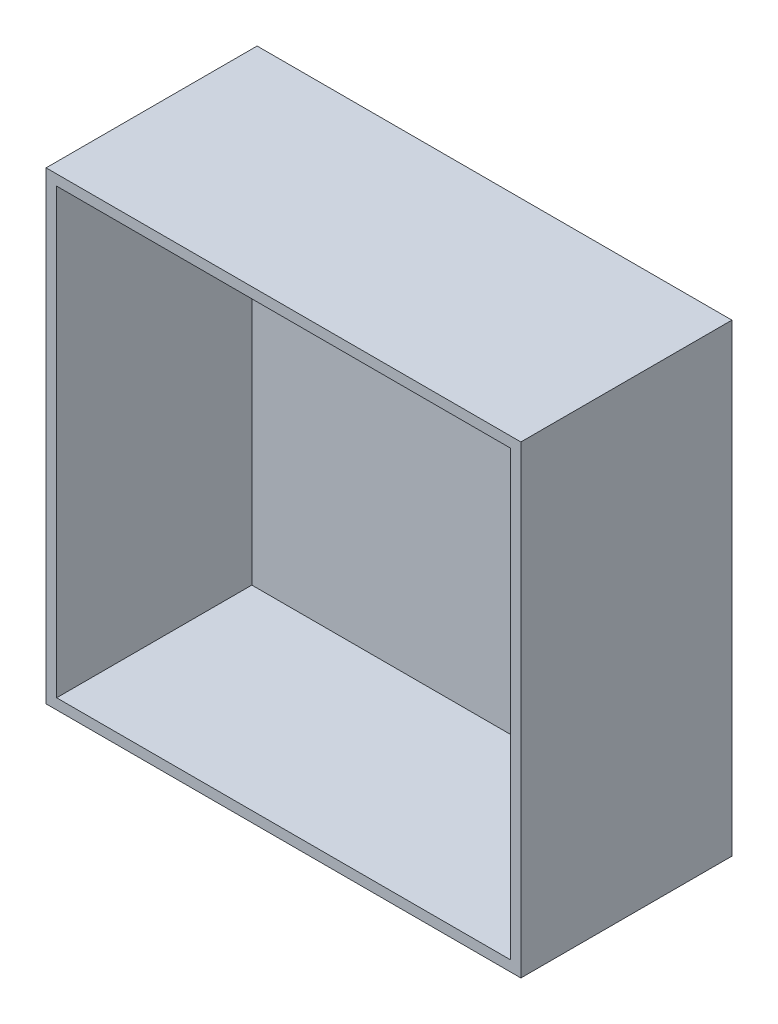
from build123d import *

# Parameters (mm, degrees)
SKETCH_1_W       = 90
SKETCH_1_H       = 88
TRAY_DEPTH       = 40
TRAYCAVITY_START = 3
SKETCH_2_W       = 86
SKETCH_2_H       = 84
TRAYCAVITY_DEPTH = 37


with BuildPart() as part:
    # 草图1 → Tray (new body)
    with BuildSketch(Plane.XY):
        with Locations((165, 0)):
            Rectangle(SKETCH_1_W, SKETCH_1_H)
    extrude(amount=TRAY_DEPTH)

    # 草图2 → TrayCavity (cut)
    with BuildSketch(Plane.XY.offset(TRAYCAVITY_START)):
        with Locations((165, 0)):
            Rectangle(SKETCH_2_W, SKETCH_2_H)
    extrude(amount=TRAYCAVITY_DEPTH, mode=Mode.SUBTRACT)


solid = part.part
